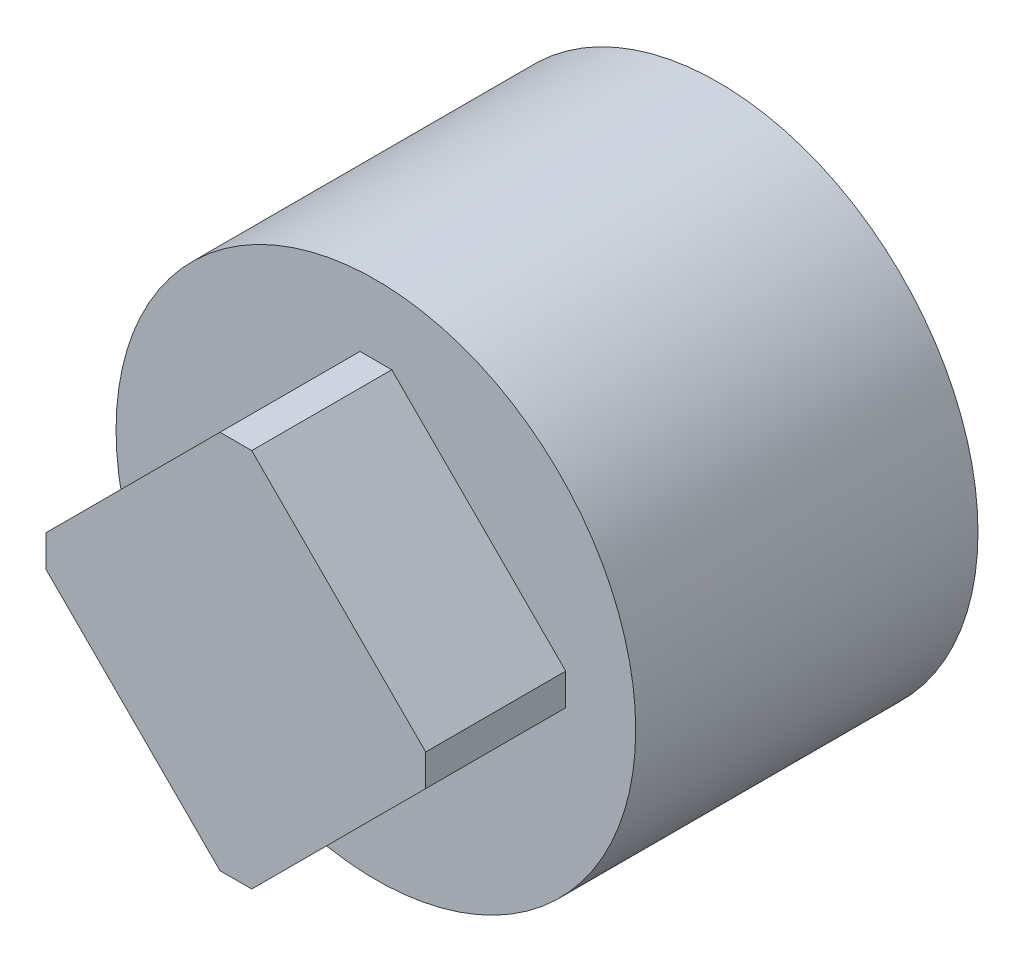
from build123d import *

# Parameters (mm, degrees)
REPLACEABLE_START                           = 1
SKETCH1_R                                   = 16.7
REPLACEABLE_DRIVE_INSERT_BODY_DEPTH         = 22
COMMON_START                                = 23
COMMON_POSITIVE_DRIVE_TANG_DEPTH            = 9
VALVE_START                                 = 1
VALVE_STEM_SOCKET_NOMINAL_FLATS_11_MM_DEPTH = 19.1
STEM_START                                  = 1
SKETCH4_R                                   = 10.2
STEM_CORNER_CLEARANCE_AT_ENTRY_DEPTH        = 1.1


with BuildPart() as part:
    # Sketch1 → Replaceable drive insert body (new body)
    with BuildSketch(Plane.XY.offset(REPLACEABLE_START)):
        Circle(SKETCH1_R)
    extrude(amount=REPLACEABLE_DRIVE_INSERT_BODY_DEPTH)

    # Sketch2 → Common positive drive tang (add)
    with BuildSketch(Plane.XY.offset(COMMON_START)):
        Polygon((1.02, 12.202896808), (-1.02, 12.202896808), (-12.202896808, 1.02), (-12.202896808, -1.02), (-1.02, -12.202896808), (1.02, -12.202896808), (12.202896808, -1.02), (12.202896808, 1.02), align=None)
    extrude(amount=COMMON_POSITIVE_DRIVE_TANG_DEPTH)

    # Sketch3 → Valve stem socket, nominal flats 11 mm (cut)
    with BuildSketch(Plane.XY.offset(VALVE_START)):
        Polygon((1.02, 6.899595949), (-1.02, 6.899595949), (-6.899595949, 1.02), (-6.899595949, -1.02), (-1.02, -6.899595949), (1.02, -6.899595949), (6.899595949, -1.02), (6.899595949, 1.02), align=None)
    extrude(amount=VALVE_STEM_SOCKET_NOMINAL_FLATS_11_MM_DEPTH, mode=Mode.SUBTRACT)

    # Sketch4 → Stem corner clearance at entry (cut)
    with BuildSketch(Plane.XY.offset(STEM_START)):
        Circle(SKETCH4_R)
    extrude(amount=STEM_CORNER_CLEARANCE_AT_ENTRY_DEPTH, mode=Mode.SUBTRACT)


solid = part.part
